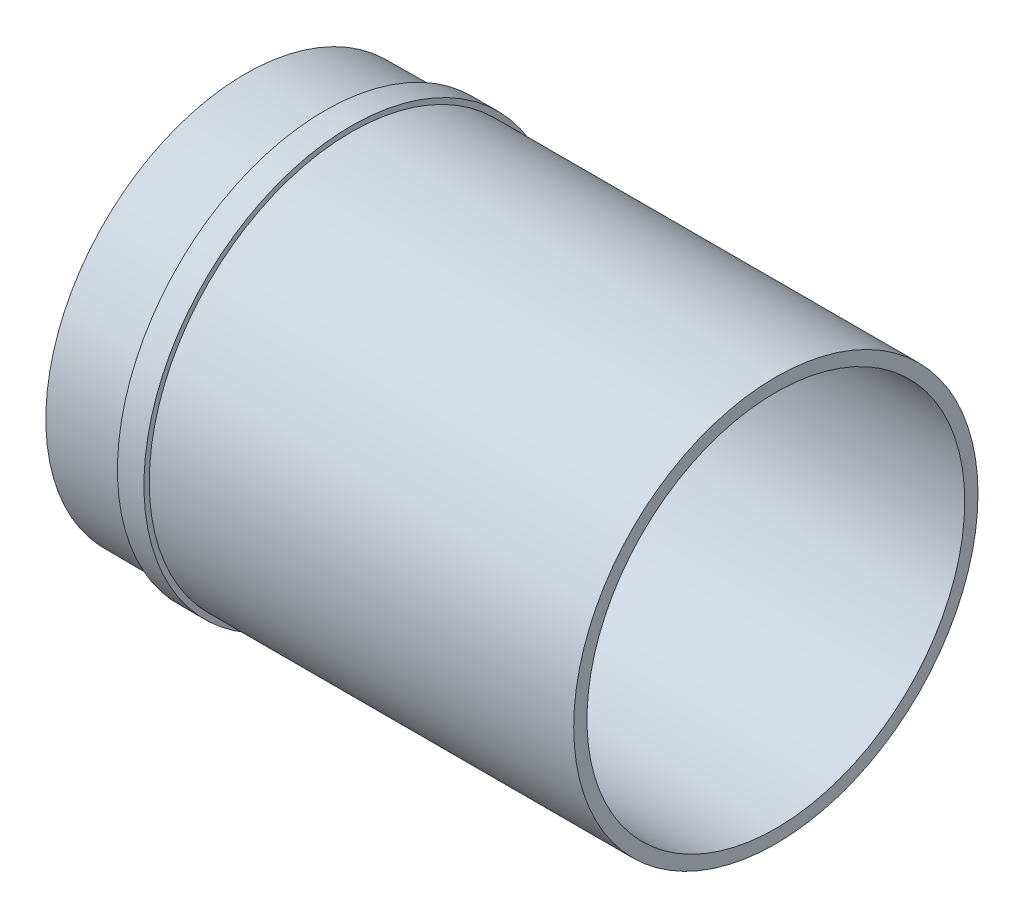
from build123d import *


with BuildPart() as part:
    # Sketch1 → Revolve1 (revolve)
    with BuildSketch(Plane.XY, mode=Mode.PRIVATE) as revolve1_sk:
        with BuildLine():
            Line((0, 3633.5), (0, 3635.5))
            ThreePointArc((0, 3635.5), (-5.000004729, 3635.496561675), (-10, 3635.486246708))
            Line((-10, 3635.486246708), (-10, 3632.986237243))
            Line((-10, 3632.986237243), (-10, 3632.686236107))
            ThreePointArc((-10, 3632.686236107), (-25.000213137, 3632.613973345), (-40, 3632.479771451))
            Line((-40, 3632.479771451), (-40, 3630.279637989))
            ThreePointArc((-40, 3630.279637989), (-22.500261409, 3630.430275909), (-5, 3630.496556946))
            Line((-5, 3630.496556946), (-5, 3628.5))
            Line((-5, 3628.5), (160, 3628.5))
            Line((160, 3628.5), (160, 3633.5))
            Line((160, 3633.5), (0, 3633.5))
        make_face()
        with BuildLine():
            Line((-40, 3628.5), (-5, 3628.5))
            Line((-5, 3628.5), (-5, 3630.496556946))
            ThreePointArc((-5, 3630.496556946), (-22.500261409, 3630.430275909), (-40, 3630.279637989))
            Line((-40, 3630.279637989), (-40, 3628.5))
        make_face()
    revolve(revolve1_sk.sketch.rotate(Axis((0, 3557.296761587, 0), (-1, 0, 0)), 90), axis=Axis((0, 3557.296761587, 0), (-1, 0, 0)))


solid = part.part
